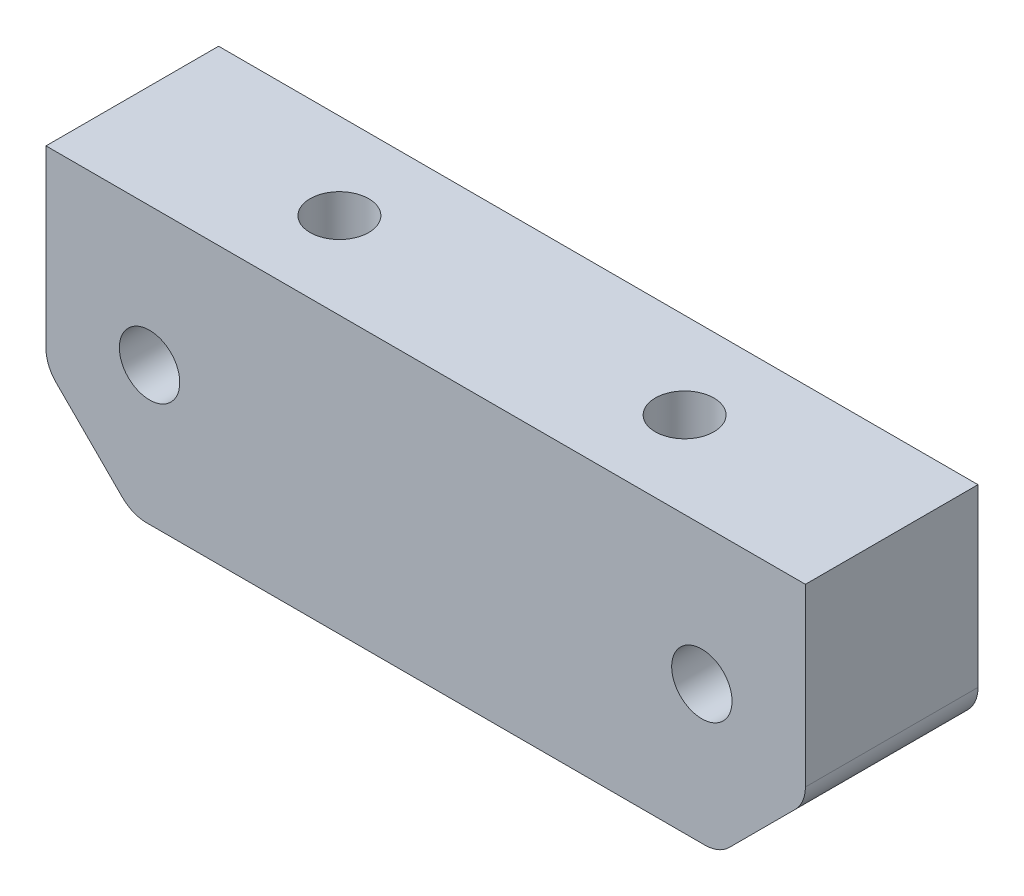
from build123d import *

# Parameters (mm, degrees)
SKETCH1_W           = 44
SKETCH1_H           = 16
BOSS_EXTRUDE1_DEPTH = 10
SKETCH2_R           = 1.7
CUT_EXTRUDE1_DEPTH  = 25
SKETCH3_R           = 1.75
CUT_EXTRUDE2_DEPTH  = 25
CHAMFER1_SIZE       = 5
FILLET1_R           = 2
SKETCH4_R           = 3.5
CUT_EXTRUDE3_DEPTH  = 4


with BuildPart() as part:
    # Sketch1 → Boss-Extrude1 (new body)
    with BuildSketch(Plane.XY):
        Rectangle(SKETCH1_W, SKETCH1_H)
    extrude(amount=BOSS_EXTRUDE1_DEPTH)

    # Sketch2 → Cut-Extrude1 (cut)
    with BuildSketch(Plane.XZ.offset(8)):
        with Locations(Location((-10, 5, 0), (0, 0, 270))):
            Circle(SKETCH2_R)
        with Locations(Location((10, 5, 0), (0, 0, 270))):
            Circle(SKETCH2_R)
    extrude(amount=-CUT_EXTRUDE1_DEPTH, mode=Mode.SUBTRACT)

    # Sketch3 → Cut-Extrude2 (cut)
    with BuildSketch(Plane.XY.offset(10)):
        with Locations((-16, 0)):
            Circle(SKETCH3_R)
        with Locations(Location((16, 0, 0), (0, 0, 180))):
            Circle(SKETCH3_R)
    extrude(amount=-CUT_EXTRUDE2_DEPTH, mode=Mode.SUBTRACT)

    # Chamfer1
    chamfer1_edges = [part.edges().sort_by_distance(p)[0] for p in [
        (22, -8, 5),
        (-22, -8, 5),
    ]]
    chamfer(chamfer1_edges, length=CHAMFER1_SIZE)

    # Fillet1
    fillet1_edges = [part.edges().sort_by_distance(p)[0] for p in [
        (22, -3, 5),
        (-17, -8, 5),
        (17, -8, 5),
        (-22, -3, 5),
    ]]
    fillet(fillet1_edges, radius=FILLET1_R)

    # Sketch4 → Cut-Extrude3 (cut)
    with BuildSketch(Plane.XZ.offset(8)):
        with Locations(Location((10, 5, 0), (0, 0, 270))):
            Circle(SKETCH4_R)
        with Locations(Location((-10, 5, 0), (0, 0, 270))):
            Circle(SKETCH4_R)
    extrude(amount=-CUT_EXTRUDE3_DEPTH, mode=Mode.SUBTRACT)


solid = part.part
